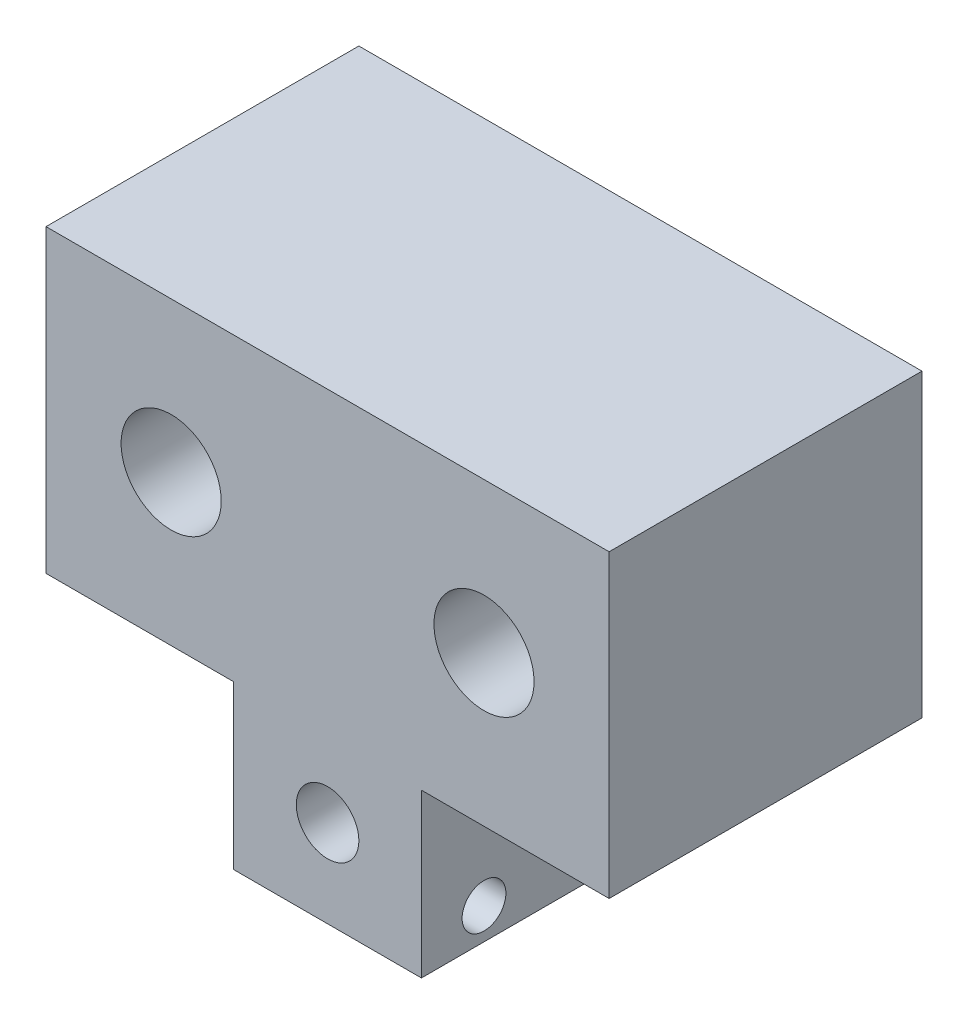
from build123d import *

# Parameters (mm, degrees)
ESQUISSE1_W             = 45
ESQUISSE1_H             = 24
ESQUISSE1_R             = 4
BOSS_EXTRU_1_DEPTH      = 25
ESQUISSE2_W             = 15
ESQUISSE2_H             = 13
ESQUISSE2_R             = 2.5
BOSS_EXTRU_2_DEPTH      = 20
ESQUISSE3_R             = 1.75
ENL_V_MAT_EXTRU_1_DEPTH = 20


with BuildPart() as part:
    # Esquisse1 → Boss.-Extru.1 (new body)
    with BuildSketch(Plane.XY):
        with Locations((4.197614073, -0.216957606)):
            Rectangle(ESQUISSE1_W, ESQUISSE1_H)
        with Locations((-8.302385927, -0.216957606)):
            Circle(ESQUISSE1_R, mode=Mode.SUBTRACT)
        with Locations((16.697614073, -0.216957606)):
            Circle(ESQUISSE1_R, mode=Mode.SUBTRACT)
    extrude(amount=BOSS_EXTRU_1_DEPTH)

    # Esquisse2 → Boss.-Extru.2 (add)
    with BuildSketch(Plane.XY.offset(25)):
        with Locations((4.197614073, -18.716957606)):
            Rectangle(ESQUISSE2_W, ESQUISSE2_H)
        with Locations((4.197614073, -18.216957606)):
            Circle(ESQUISSE2_R, mode=Mode.SUBTRACT)
    extrude(amount=-BOSS_EXTRU_2_DEPTH)

    # Esquisse3 → Enlèv. mat.-Extru.1 (cut)
    with BuildSketch(Plane.ZY.offset(3.302385927)):
        with Locations((20, -22.716957606)):
            Circle(ESQUISSE3_R)
    extrude(amount=-ENL_V_MAT_EXTRU_1_DEPTH, mode=Mode.SUBTRACT)


solid = part.part
